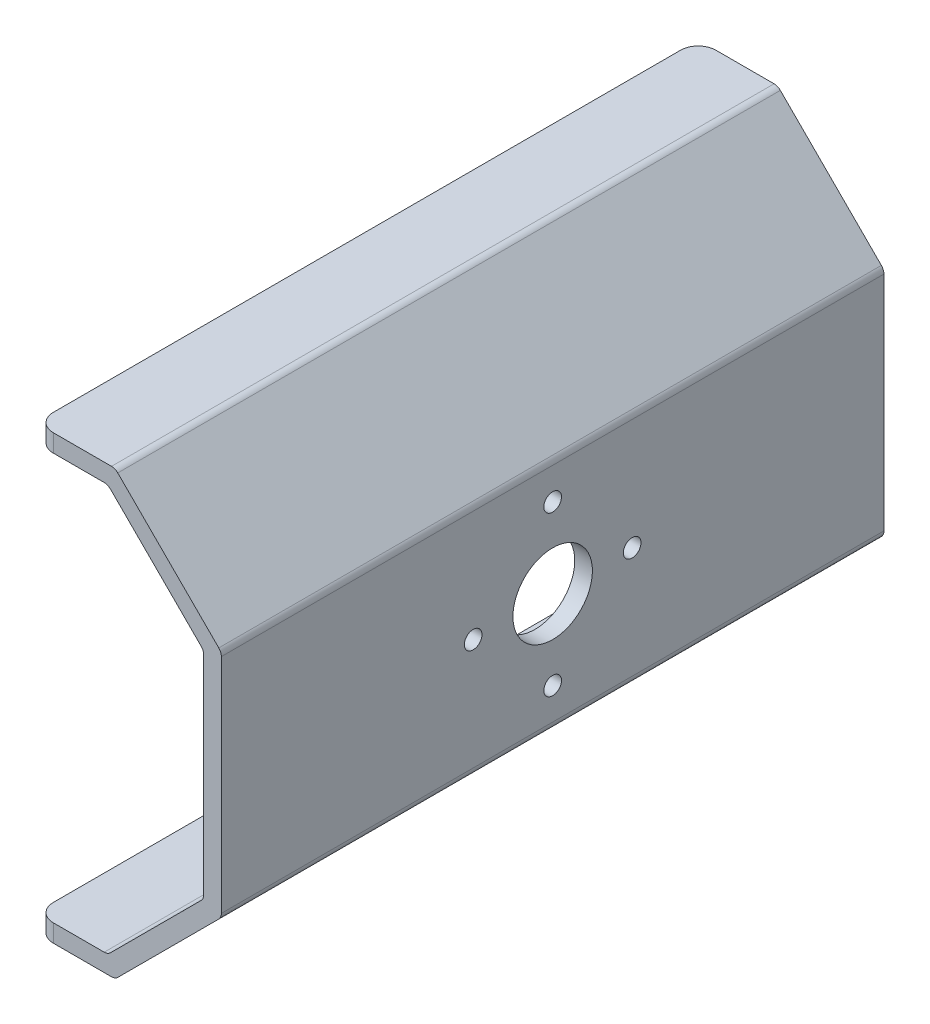
from build123d import *

# Parameters (mm, degrees)
EXTRU_MINCE1_DEPTH      = 75
ESQUISSE2_R             = 4.5
ESQUISSE2_R_2           = 1
ENL_V_MAT_EXTRU_1_DEPTH = 10
CONG_1_R                = 2
CONG_2_R                = 2
CONG_3_R                = 2
CONG_4_R                = 2
CONG_5_R                = 1
CONG_6_R                = 1
CONG_7_R                = 1
CONG_8_R                = 1
CONG_9_R                = 1
CONG_10_R               = 1
CONG_11_R               = 1
CONG_12_R               = 1


with BuildPart() as part:
    # Esquisse1 → Extru.-Mince1 (new body)
    with BuildSketch(Plane.XY):
        Polygon((-7.619194622, 27.166626694), (1.380805378, 27.166626694), (13.401620658, 15.145811413), (13.401620658, -10.854188587), (1.380805378, -22.875003867), (-7.619194622, -22.875003867), (-7.619194622, -20.875003867), (0.552378253, -20.875003867), (11.401620658, -10.025761462), (11.401620658, 14.317384289), (0.552378253, 25.166626694), (-7.619194622, 25.166626694), align=None)
    extrude(amount=EXTRU_MINCE1_DEPTH)

    # Esquisse2 → Enlèv. mat.-Extru.1 (cut)
    with BuildSketch(Plane(origin=(13.401620658, 0, 0), x_dir=(0, 0, -1), z_dir=(1, 0, 0))):
        with Locations(Location((-37.5, 2.145811413, 0), (0, 0, 90))):
            Circle(ESQUISSE2_R)
        with Locations(Location((-46.5, 2.145811413, 0), (0, 0, 90))):
            Circle(ESQUISSE2_R_2)
        with Locations(Location((-28.5, 2.145811413, 0), (0, 0, 90))):
            Circle(ESQUISSE2_R_2)
        with Locations(Location((-37.5, 11.145811413, 0), (0, 0, 90))):
            Circle(ESQUISSE2_R_2)
        with Locations(Location((-37.5, -6.854188587, 0), (0, 0, 90))):
            Circle(ESQUISSE2_R_2)
    extrude(amount=-ENL_V_MAT_EXTRU_1_DEPTH, mode=Mode.SUBTRACT)

    # Congé1
    cong_1_edges = [part.edges().sort_by_distance(p)[0] for p in [
        (-7.619194622, 26.166626694, 0),
    ]]
    fillet(cong_1_edges, radius=CONG_1_R)

    # Congé2
    cong_2_edges = [part.edges().sort_by_distance(p)[0] for p in [
        (-7.619194622, -21.875003867, 0),
    ]]
    fillet(cong_2_edges, radius=CONG_2_R)

    # Congé3
    cong_3_edges = [part.edges().sort_by_distance(p)[0] for p in [
        (-7.619194622, -21.875003867, 75),
    ]]
    fillet(cong_3_edges, radius=CONG_3_R)

    # Congé4
    cong_4_edges = [part.edges().sort_by_distance(p)[0] for p in [
        (-7.619194622, 26.166626694, 75),
    ]]
    fillet(cong_4_edges, radius=CONG_4_R)

    # Congé5
    cong_5_edges = [part.edges().sort_by_distance(p)[0] for p in [
        (11.401620658, 14.317384289, 37.5),
    ]]
    fillet(cong_5_edges, radius=CONG_5_R)

    # Congé6
    cong_6_edges = [part.edges().sort_by_distance(p)[0] for p in [
        (11.401620658, -10.025761462, 37.5),
    ]]
    fillet(cong_6_edges, radius=CONG_6_R)

    # Congé7
    cong_7_edges = [part.edges().sort_by_distance(p)[0] for p in [
        (13.401620658, -10.854188587, 37.5),
    ]]
    fillet(cong_7_edges, radius=CONG_7_R)

    # Congé8
    cong_8_edges = [part.edges().sort_by_distance(p)[0] for p in [
        (13.401620658, 15.145811413, 37.5),
    ]]
    fillet(cong_8_edges, radius=CONG_8_R)

    # Congé9
    cong_9_edges = [part.edges().sort_by_distance(p)[0] for p in [
        (1.380805378, 27.166626694, 37.5),
    ]]
    fillet(cong_9_edges, radius=CONG_9_R)

    # Congé10
    cong_10_edges = [part.edges().sort_by_distance(p)[0] for p in [
        (1.380805378, -22.875003867, 37.5),
    ]]
    fillet(cong_10_edges, radius=CONG_10_R)

    # Congé11
    cong_11_edges = [part.edges().sort_by_distance(p)[0] for p in [
        (0.552378253, 25.166626694, 37.5),
    ]]
    fillet(cong_11_edges, radius=CONG_11_R)

    # Congé12
    cong_12_edges = [part.edges().sort_by_distance(p)[0] for p in [
        (0.552378253, -20.875003867, 37.5),
    ]]
    fillet(cong_12_edges, radius=CONG_12_R)


solid = part.part
